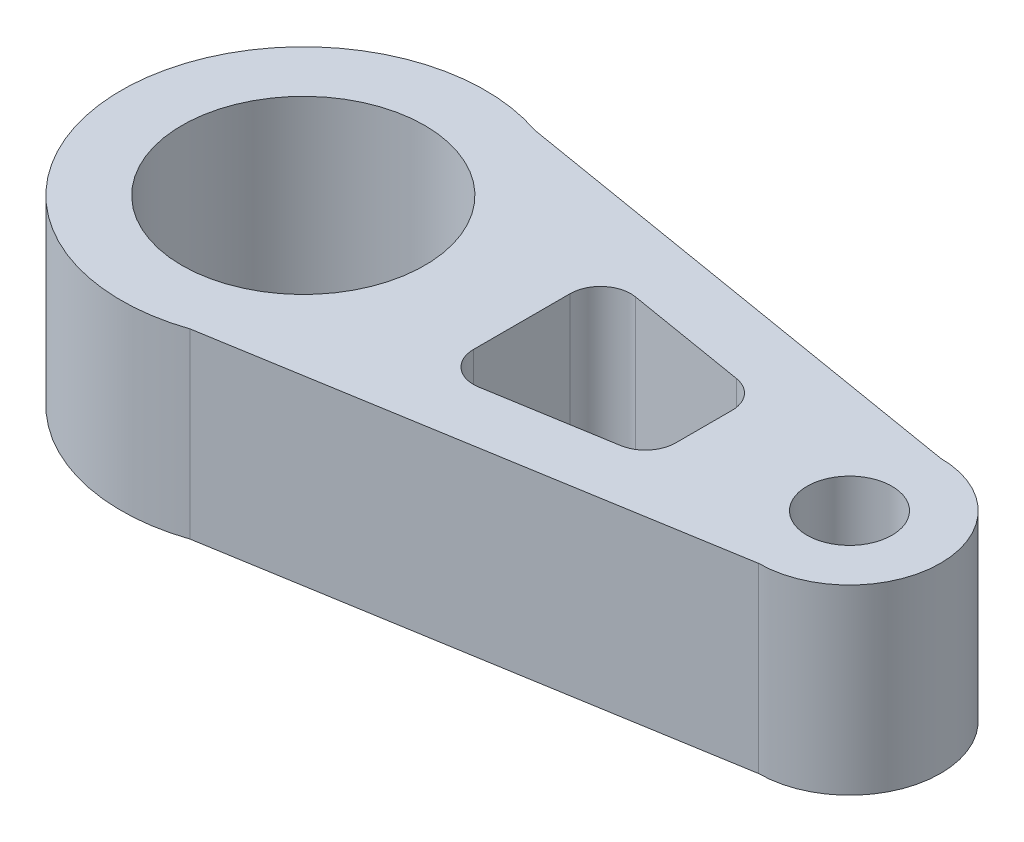
from build123d import *

# Parameters (mm, degrees)
SKETCH1_R           = 12.7
SKETCH1_R_2         = 4.445
BOSS_EXTRUDE2_DEPTH = 19.05


with BuildPart() as part:
    # Sketch1 → Boss-Extrude2 (new body)
    with BuildSketch(Plane(origin=(0, 0, 0), x_dir=(1, 0, 0), z_dir=(0, 1, 0))):
        with BuildLine():
            Line((6.178378378, -18.02027027), (57.15, -9.525))
            ThreePointArc((57.15, -9.525), (66.675, 0), (57.15, 9.525))
            Line((57.15, 9.525), (6.178378378, 18.02027027))
            ThreePointArc((6.178378378, 18.02027027), (-19.05, 0), (6.178378378, -18.02027027))
        make_face()
        with Locations(Location((0, 0, 0), (0, 0, 270))):
            Circle(SKETCH1_R, mode=Mode.SUBTRACT)
        with BuildLine():
            ThreePointArc((22.86, 5.054447816), (23.982759705, 7.477036261), (26.556966785, 8.186248525))
            Line((26.556966785, 8.186248525), (39.256966785, 6.069581858))
            ThreePointArc((39.256966785, 6.069581858), (41.157588444, 4.990021445), (41.91, 2.93778115))
            Line((41.91, 2.93778115), (41.91, -2.93778115))
            ThreePointArc((41.91, -2.93778115), (41.157588444, -4.990021445), (39.256966785, -6.069581858))
            Line((39.256966785, -6.069581858), (26.556966785, -8.186248525))
            ThreePointArc((26.556966785, -8.186248525), (23.982759705, -7.477036261), (22.86, -5.054447816))
            Line((22.86, -5.054447816), (22.86, 5.054447816))
        make_face(mode=Mode.SUBTRACT)
        with Locations(Location((57.15, 0, 0), (0, 0, 270))):
            Circle(SKETCH1_R_2, mode=Mode.SUBTRACT)
    extrude(amount=BOSS_EXTRUDE2_DEPTH)


solid = part.part
